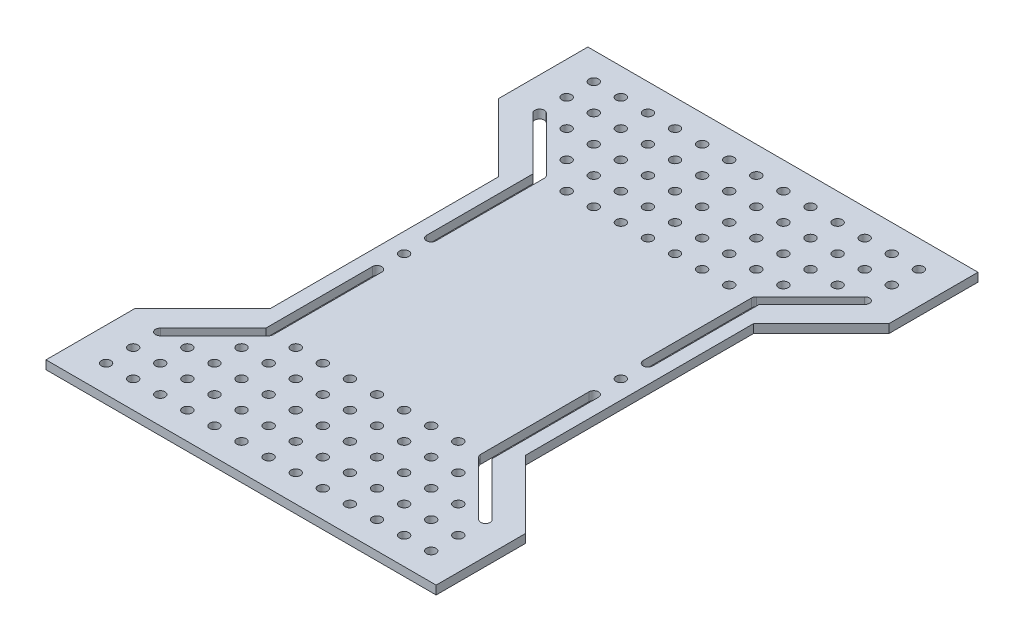
from build123d import *

# Parameters (mm, degrees)
CROQUIS1_R              = 1.75
SALIENTE_EXTRUIR1_DEPTH = 3.175
CORTAR_EXTRUIR1_DEPTH   = 247.467199897
CORTAR_EXTRUIR2_DEPTH   = 247.467199897


with BuildPart() as part:
    # Croquis1 → Saliente-Extruir1 (new body)
    with BuildSketch(Plane(origin=(0, 0, 0), x_dir=(1, 0, 0), z_dir=(0, 1, 0))):
        Polygon((25, 142.1), (25, 57.9), (0, 32.9), (0, 0), (144, 0), (144, 32.9), (119, 57.9), (119, 142.1), (144, 167.1), (144, 200), (0, 200), (0, 167.1), align=None)
        with Locations(Location((62.175, 20, 0), (0, 0, 270))):
            Circle(CROQUIS1_R, mode=Mode.SUBTRACT)
        with Locations(Location((92.175, 10, 0), (0, 0, 270))):
            Circle(CROQUIS1_R, mode=Mode.SUBTRACT)
        with Locations(Location((122.175, 10, 0), (0, 0, 270))):
            Circle(CROQUIS1_R, mode=Mode.SUBTRACT)
        with Locations(Location((132.175, 10, 0), (0, 0, 270))):
            Circle(CROQUIS1_R, mode=Mode.SUBTRACT)
        with Locations(Location((102.175, 10, 0), (0, 0, 270))):
            Circle(CROQUIS1_R, mode=Mode.SUBTRACT)
        with Locations(Location((112.175, 10, 0), (0, 0, 270))):
            Circle(CROQUIS1_R, mode=Mode.SUBTRACT)
        with Locations(Location((42.175, 20, 0), (0, 0, 270))):
            Circle(CROQUIS1_R, mode=Mode.SUBTRACT)
        with Locations(Location((52.175, 20, 0), (0, 0, 270))):
            Circle(CROQUIS1_R, mode=Mode.SUBTRACT)
        with Locations(Location((22.175, 20, 0), (0, 0, 270))):
            Circle(CROQUIS1_R, mode=Mode.SUBTRACT)
        with Locations(Location((32.175, 20, 0), (0, 0, 270))):
            Circle(CROQUIS1_R, mode=Mode.SUBTRACT)
        with Locations(Location((42.175, 10, 0), (0, 0, 270))):
            Circle(CROQUIS1_R, mode=Mode.SUBTRACT)
        with Locations(Location((52.175, 10, 0), (0, 0, 270))):
            Circle(CROQUIS1_R, mode=Mode.SUBTRACT)
        with Locations(Location((22.175, 10, 0), (0, 0, 270))):
            Circle(CROQUIS1_R, mode=Mode.SUBTRACT)
        with Locations(Location((32.175, 10, 0), (0, 0, 270))):
            Circle(CROQUIS1_R, mode=Mode.SUBTRACT)
        with Locations(Location((72.175, 10, 0), (0, 0, 270))):
            Circle(CROQUIS1_R, mode=Mode.SUBTRACT)
        with Locations(Location((122.175, 40, 0), (0, 0, 270))):
            Circle(CROQUIS1_R, mode=Mode.SUBTRACT)
        with Locations(Location((32.175, 50, 0), (0, 0, 270))):
            Circle(CROQUIS1_R, mode=Mode.SUBTRACT)
        with Locations(Location((102.175, 40, 0), (0, 0, 270))):
            Circle(CROQUIS1_R, mode=Mode.SUBTRACT)
        with Locations(Location((112.175, 40, 0), (0, 0, 270))):
            Circle(CROQUIS1_R, mode=Mode.SUBTRACT)
        with Locations(Location((72.175, 40, 0), (0, 0, 270))):
            Circle(CROQUIS1_R, mode=Mode.SUBTRACT)
        with Locations(Location((62.175, 40, 0), (0, 0, 270))):
            Circle(CROQUIS1_R, mode=Mode.SUBTRACT)
        with Locations(Location((92.175, 40, 0), (0, 0, 270))):
            Circle(CROQUIS1_R, mode=Mode.SUBTRACT)
        with Locations(Location((82.175, 40, 0), (0, 0, 270))):
            Circle(CROQUIS1_R, mode=Mode.SUBTRACT)
        with Locations(Location((122.175, 30, 0), (0, 0, 270))):
            Circle(CROQUIS1_R, mode=Mode.SUBTRACT)
        with Locations(Location((132.175, 30, 0), (0, 0, 270))):
            Circle(CROQUIS1_R, mode=Mode.SUBTRACT)
        with Locations(Location((102.175, 30, 0), (0, 0, 270))):
            Circle(CROQUIS1_R, mode=Mode.SUBTRACT)
        with Locations(Location((112.175, 30, 0), (0, 0, 270))):
            Circle(CROQUIS1_R, mode=Mode.SUBTRACT)
        with Locations(Location((42.175, 40, 0), (0, 0, 270))):
            Circle(CROQUIS1_R, mode=Mode.SUBTRACT)
        with Locations(Location((52.175, 40, 0), (0, 0, 270))):
            Circle(CROQUIS1_R, mode=Mode.SUBTRACT)
        with Locations(Location((22.175, 40, 0), (0, 0, 270))):
            Circle(CROQUIS1_R, mode=Mode.SUBTRACT)
        with Locations(Location((32.175, 40, 0), (0, 0, 270))):
            Circle(CROQUIS1_R, mode=Mode.SUBTRACT)
        with Locations(Location((132.175, 180, 0), (0, 0, 270))):
            Circle(CROQUIS1_R, mode=Mode.SUBTRACT)
        with Locations(Location((22.175, 190, 0), (0, 0, 270))):
            Circle(CROQUIS1_R, mode=Mode.SUBTRACT)
        with Locations(Location((12.175, 30, 0), (0, 0, 270))):
            Circle(CROQUIS1_R, mode=Mode.SUBTRACT)
        with Locations(Location((12.175, 170, 0), (0, 0, 270))):
            Circle(CROQUIS1_R, mode=Mode.SUBTRACT)
        with Locations(Location((12.175, 190, 0), (0, 0, 270))):
            Circle(CROQUIS1_R, mode=Mode.SUBTRACT)
        with Locations(Location((12.175, 180, 0), (0, 0, 270))):
            Circle(CROQUIS1_R, mode=Mode.SUBTRACT)
        with Locations(Location((12.175, 20, 0), (0, 0, 270))):
            Circle(CROQUIS1_R, mode=Mode.SUBTRACT)
        with Locations(Location((132.175, 190, 0), (0, 0, 270))):
            Circle(CROQUIS1_R, mode=Mode.SUBTRACT)
        with Locations(Location((92.175, 190, 0), (0, 0, 270))):
            Circle(CROQUIS1_R, mode=Mode.SUBTRACT)
        with Locations(Location((102.175, 190, 0), (0, 0, 270))):
            Circle(CROQUIS1_R, mode=Mode.SUBTRACT)
        with Locations(Location((112.175, 180, 0), (0, 0, 270))):
            Circle(CROQUIS1_R, mode=Mode.SUBTRACT)
        with Locations(Location((122.175, 180, 0), (0, 0, 270))):
            Circle(CROQUIS1_R, mode=Mode.SUBTRACT)
        with Locations(Location((92.175, 180, 0), (0, 0, 270))):
            Circle(CROQUIS1_R, mode=Mode.SUBTRACT)
        with Locations(Location((102.175, 180, 0), (0, 0, 270))):
            Circle(CROQUIS1_R, mode=Mode.SUBTRACT)
        with Locations(Location((32.175, 190, 0), (0, 0, 270))):
            Circle(CROQUIS1_R, mode=Mode.SUBTRACT)
        with Locations(Location((42.175, 190, 0), (0, 0, 270))):
            Circle(CROQUIS1_R, mode=Mode.SUBTRACT)
        with Locations(Location((42.175, 30, 0), (0, 0, 270))):
            Circle(CROQUIS1_R, mode=Mode.SUBTRACT)
        with Locations(Location((52.175, 30, 0), (0, 0, 270))):
            Circle(CROQUIS1_R, mode=Mode.SUBTRACT)
        with Locations(Location((22.175, 30, 0), (0, 0, 270))):
            Circle(CROQUIS1_R, mode=Mode.SUBTRACT)
        with Locations(Location((32.175, 30, 0), (0, 0, 270))):
            Circle(CROQUIS1_R, mode=Mode.SUBTRACT)
        with Locations(Location((82.175, 30, 0), (0, 0, 270))):
            Circle(CROQUIS1_R, mode=Mode.SUBTRACT)
        with Locations(Location((92.175, 30, 0), (0, 0, 270))):
            Circle(CROQUIS1_R, mode=Mode.SUBTRACT)
        with Locations(Location((62.175, 30, 0), (0, 0, 270))):
            Circle(CROQUIS1_R, mode=Mode.SUBTRACT)
        with Locations(Location((72.175, 30, 0), (0, 0, 270))):
            Circle(CROQUIS1_R, mode=Mode.SUBTRACT)
        with Locations(Location((92.175, 20, 0), (0, 0, 270))):
            Circle(CROQUIS1_R, mode=Mode.SUBTRACT)
        with Locations(Location((72.175, 20, 0), (0, 0, 270))):
            Circle(CROQUIS1_R, mode=Mode.SUBTRACT)
        with Locations(Location((122.175, 20, 0), (0, 0, 270))):
            Circle(CROQUIS1_R, mode=Mode.SUBTRACT)
        with Locations(Location((132.175, 20, 0), (0, 0, 270))):
            Circle(CROQUIS1_R, mode=Mode.SUBTRACT)
        with Locations(Location((102.175, 20, 0), (0, 0, 270))):
            Circle(CROQUIS1_R, mode=Mode.SUBTRACT)
        with Locations(Location((112.175, 20, 0), (0, 0, 270))):
            Circle(CROQUIS1_R, mode=Mode.SUBTRACT)
        with Locations(Location((32.175, 60, 0), (0, 0, 270))):
            Circle(CROQUIS1_R, mode=Mode.SUBTRACT)
        with Locations(Location((62.175, 50, 0), (0, 0, 270))):
            Circle(CROQUIS1_R, mode=Mode.SUBTRACT)
        with Locations(Location((72.175, 50, 0), (0, 0, 270))):
            Circle(CROQUIS1_R, mode=Mode.SUBTRACT)
        with Locations(Location((42.175, 50, 0), (0, 0, 270))):
            Circle(CROQUIS1_R, mode=Mode.SUBTRACT)
        with Locations(Location((52.175, 50, 0), (0, 0, 270))):
            Circle(CROQUIS1_R, mode=Mode.SUBTRACT)
        with Locations(Location((102.175, 50, 0), (0, 0, 270))):
            Circle(CROQUIS1_R, mode=Mode.SUBTRACT)
        with Locations(Location((112.175, 50, 0), (0, 0, 270))):
            Circle(CROQUIS1_R, mode=Mode.SUBTRACT)
        with Locations(Location((82.175, 50, 0), (0, 0, 270))):
            Circle(CROQUIS1_R, mode=Mode.SUBTRACT)
        with Locations(Location((92.175, 50, 0), (0, 0, 270))):
            Circle(CROQUIS1_R, mode=Mode.SUBTRACT)
        with Locations(Location((32.175, 70, 0), (0, 0, 270))):
            Circle(CROQUIS1_R, mode=Mode.SUBTRACT)
        with Locations(Location((112.175, 60, 0), (0, 0, 270))):
            Circle(CROQUIS1_R, mode=Mode.SUBTRACT)
        with Locations(Location((32.175, 80, 0), (0, 0, 270))):
            Circle(CROQUIS1_R, mode=Mode.SUBTRACT)
        with Locations(Location((112.175, 70, 0), (0, 0, 270))):
            Circle(CROQUIS1_R, mode=Mode.SUBTRACT)
        with Locations(Location((32.175, 90, 0), (0, 0, 270))):
            Circle(CROQUIS1_R, mode=Mode.SUBTRACT)
        with Locations(Location((112.175, 80, 0), (0, 0, 270))):
            Circle(CROQUIS1_R, mode=Mode.SUBTRACT)
        with Locations(Location((32.175, 100, 0), (0, 0, 270))):
            Circle(CROQUIS1_R, mode=Mode.SUBTRACT)
        with Locations(Location((112.175, 90, 0), (0, 0, 270))):
            Circle(CROQUIS1_R, mode=Mode.SUBTRACT)
        with Locations(Location((32.175, 110, 0), (0, 0, 270))):
            Circle(CROQUIS1_R, mode=Mode.SUBTRACT)
        with Locations(Location((112.175, 100, 0), (0, 0, 270))):
            Circle(CROQUIS1_R, mode=Mode.SUBTRACT)
        with Locations(Location((32.175, 120, 0), (0, 0, 270))):
            Circle(CROQUIS1_R, mode=Mode.SUBTRACT)
        with Locations(Location((112.175, 110, 0), (0, 0, 270))):
            Circle(CROQUIS1_R, mode=Mode.SUBTRACT)
        with Locations(Location((102.175, 160, 0), (0, 0, 270))):
            Circle(CROQUIS1_R, mode=Mode.SUBTRACT)
        with Locations(Location((112.175, 160, 0), (0, 0, 270))):
            Circle(CROQUIS1_R, mode=Mode.SUBTRACT)
        with Locations(Location((82.175, 160, 0), (0, 0, 270))):
            Circle(CROQUIS1_R, mode=Mode.SUBTRACT)
        with Locations(Location((92.175, 160, 0), (0, 0, 270))):
            Circle(CROQUIS1_R, mode=Mode.SUBTRACT)
        with Locations(Location((32.175, 170, 0), (0, 0, 270))):
            Circle(CROQUIS1_R, mode=Mode.SUBTRACT)
        with Locations(Location((42.175, 170, 0), (0, 0, 270))):
            Circle(CROQUIS1_R, mode=Mode.SUBTRACT)
        with Locations(Location((42.175, 150, 0), (0, 0, 270))):
            Circle(CROQUIS1_R, mode=Mode.SUBTRACT)
        with Locations(Location((52.175, 150, 0), (0, 0, 270))):
            Circle(CROQUIS1_R, mode=Mode.SUBTRACT)
        with Locations(Location((92.175, 150, 0), (0, 0, 270))):
            Circle(CROQUIS1_R, mode=Mode.SUBTRACT)
        with Locations(Location((82.175, 150, 0), (0, 0, 270))):
            Circle(CROQUIS1_R, mode=Mode.SUBTRACT)
        with Locations(Location((32.175, 150, 0), (0, 0, 270))):
            Circle(CROQUIS1_R, mode=Mode.SUBTRACT)
        with Locations(Location((112.175, 140, 0), (0, 0, 270))):
            Circle(CROQUIS1_R, mode=Mode.SUBTRACT)
        with Locations(Location((32.175, 130, 0), (0, 0, 270))):
            Circle(CROQUIS1_R, mode=Mode.SUBTRACT)
        with Locations(Location((112.175, 120, 0), (0, 0, 270))):
            Circle(CROQUIS1_R, mode=Mode.SUBTRACT)
        with Locations(Location((72.175, 190, 0), (0, 0, 270))):
            Circle(CROQUIS1_R, mode=Mode.SUBTRACT)
        with Locations(Location((82.175, 190, 0), (0, 0, 270))):
            Circle(CROQUIS1_R, mode=Mode.SUBTRACT)
        with Locations(Location((52.175, 190, 0), (0, 0, 270))):
            Circle(CROQUIS1_R, mode=Mode.SUBTRACT)
        with Locations(Location((62.175, 190, 0), (0, 0, 270))):
            Circle(CROQUIS1_R, mode=Mode.SUBTRACT)
        with Locations(Location((112.175, 190, 0), (0, 0, 270))):
            Circle(CROQUIS1_R, mode=Mode.SUBTRACT)
        with Locations(Location((122.175, 190, 0), (0, 0, 270))):
            Circle(CROQUIS1_R, mode=Mode.SUBTRACT)
        with Locations(Location((62.175, 150, 0), (0, 0, 270))):
            Circle(CROQUIS1_R, mode=Mode.SUBTRACT)
        with Locations(Location((72.175, 150, 0), (0, 0, 270))):
            Circle(CROQUIS1_R, mode=Mode.SUBTRACT)
        with Locations(Location((32.175, 140, 0), (0, 0, 270))):
            Circle(CROQUIS1_R, mode=Mode.SUBTRACT)
        with Locations(Location((42.175, 160, 0), (0, 0, 270))):
            Circle(CROQUIS1_R, mode=Mode.SUBTRACT)
        with Locations(Location((52.175, 160, 0), (0, 0, 270))):
            Circle(CROQUIS1_R, mode=Mode.SUBTRACT)
        with Locations(Location((32.175, 180, 0), (0, 0, 270))):
            Circle(CROQUIS1_R, mode=Mode.SUBTRACT)
        with Locations(Location((42.175, 180, 0), (0, 0, 270))):
            Circle(CROQUIS1_R, mode=Mode.SUBTRACT)
        with Locations(Location((82.175, 180, 0), (0, 0, 270))):
            Circle(CROQUIS1_R, mode=Mode.SUBTRACT)
        with Locations(Location((72.175, 180, 0), (0, 0, 270))):
            Circle(CROQUIS1_R, mode=Mode.SUBTRACT)
        with Locations(Location((22.175, 180, 0), (0, 0, 270))):
            Circle(CROQUIS1_R, mode=Mode.SUBTRACT)
        with Locations(Location((132.175, 170, 0), (0, 0, 270))):
            Circle(CROQUIS1_R, mode=Mode.SUBTRACT)
        with Locations(Location((32.175, 160, 0), (0, 0, 270))):
            Circle(CROQUIS1_R, mode=Mode.SUBTRACT)
        with Locations(Location((22.175, 160, 0), (0, 0, 270))):
            Circle(CROQUIS1_R, mode=Mode.SUBTRACT)
        with Locations(Location((22.175, 170, 0), (0, 0, 270))):
            Circle(CROQUIS1_R, mode=Mode.SUBTRACT)
        with Locations(Location((122.175, 160, 0), (0, 0, 270))):
            Circle(CROQUIS1_R, mode=Mode.SUBTRACT)
        with Locations(Location((102.175, 150, 0), (0, 0, 270))):
            Circle(CROQUIS1_R, mode=Mode.SUBTRACT)
        with Locations(Location((112.175, 150, 0), (0, 0, 270))):
            Circle(CROQUIS1_R, mode=Mode.SUBTRACT)
        with Locations(Location((62.175, 160, 0), (0, 0, 270))):
            Circle(CROQUIS1_R, mode=Mode.SUBTRACT)
        with Locations(Location((72.175, 160, 0), (0, 0, 270))):
            Circle(CROQUIS1_R, mode=Mode.SUBTRACT)
        with Locations(Location((92.175, 170, 0), (0, 0, 270))):
            Circle(CROQUIS1_R, mode=Mode.SUBTRACT)
        with Locations(Location((102.175, 170, 0), (0, 0, 270))):
            Circle(CROQUIS1_R, mode=Mode.SUBTRACT)
        with Locations(Location((112.175, 130, 0), (0, 0, 270))):
            Circle(CROQUIS1_R, mode=Mode.SUBTRACT)
        with Locations(Location((52.175, 180, 0), (0, 0, 270))):
            Circle(CROQUIS1_R, mode=Mode.SUBTRACT)
        with Locations(Location((62.175, 180, 0), (0, 0, 270))):
            Circle(CROQUIS1_R, mode=Mode.SUBTRACT)
        with Locations(Location((72.175, 170, 0), (0, 0, 270))):
            Circle(CROQUIS1_R, mode=Mode.SUBTRACT)
        with Locations(Location((82.175, 170, 0), (0, 0, 270))):
            Circle(CROQUIS1_R, mode=Mode.SUBTRACT)
        with Locations(Location((52.175, 170, 0), (0, 0, 270))):
            Circle(CROQUIS1_R, mode=Mode.SUBTRACT)
        with Locations(Location((62.175, 170, 0), (0, 0, 270))):
            Circle(CROQUIS1_R, mode=Mode.SUBTRACT)
        with Locations(Location((112.175, 170, 0), (0, 0, 270))):
            Circle(CROQUIS1_R, mode=Mode.SUBTRACT)
        with Locations(Location((122.175, 170, 0), (0, 0, 270))):
            Circle(CROQUIS1_R, mode=Mode.SUBTRACT)
        with Locations(Location((12.175, 10, 0), (0, 0, 270))):
            Circle(CROQUIS1_R, mode=Mode.SUBTRACT)
        with Locations(Location((62.175, 10, 0), (0, 0, 270))):
            Circle(CROQUIS1_R, mode=Mode.SUBTRACT)
        with Locations(Location((82.175, 20, 0), (0, 0, 270))):
            Circle(CROQUIS1_R, mode=Mode.SUBTRACT)
        with Locations(Location((82.175, 10, 0), (0, 0, 270))):
            Circle(CROQUIS1_R, mode=Mode.SUBTRACT)
    extrude(amount=SALIENTE_EXTRUIR1_DEPTH)

    # Croquis2 → Cortar-Extruir1 (cut, through all)
    with BuildSketch(Plane(origin=(0, 3.175, 0), x_dir=(1, 0, 0), z_dir=(0, 1, 0))):
        with BuildLine():
            Line((33.925, 150), (33.925, 110))
            ThreePointArc((33.925, 110), (32.175, 108.25), (30.425, 110))
            Line((30.425, 110), (30.425, 150))
            ThreePointArc((30.425, 150), (32.175, 151.75), (33.925, 150))
        make_face()
        with BuildLine():
            Line((33.925, 50), (33.925, 90))
            ThreePointArc((33.925, 90), (32.175, 91.75), (30.425, 90))
            Line((30.425, 90), (30.425, 50))
            ThreePointArc((30.425, 50), (32.175, 48.25), (33.925, 50))
        make_face()
        with BuildLine():
            Line((110.425, 50), (110.425, 90))
            ThreePointArc((110.425, 90), (112.175, 91.75), (113.925, 90))
            Line((113.925, 90), (113.925, 50))
            ThreePointArc((113.925, 50), (112.175, 48.25), (110.425, 50))
        make_face()
        with BuildLine():
            Line((110.425, 150), (110.425, 110))
            ThreePointArc((110.425, 110), (112.175, 108.25), (113.925, 110))
            Line((113.925, 110), (113.925, 150))
            ThreePointArc((113.925, 150), (112.175, 151.75), (110.425, 150))
        make_face()
    extrude(amount=-CORTAR_EXTRUIR1_DEPTH, mode=Mode.SUBTRACT)

    # Croquis3 → Cortar-Extruir2 (cut, through all)
    with BuildSketch(Plane(origin=(0, 3.175, 0), x_dir=(1, 0, 0), z_dir=(0, 1, 0))):
        with BuildLine():
            Line((30.937563133, 148.762563133), (10.937563133, 168.762563133))
            ThreePointArc((10.937563133, 168.762563133), (10.937563133, 171.237436867), (13.412436867, 171.237436867))
            Line((13.412436867, 171.237436867), (33.412436867, 151.237436867))
            ThreePointArc((33.412436867, 151.237436867), (33.412436867, 148.762563133), (30.937563133, 148.762563133))
        make_face()
        with BuildLine():
            Line((113.412436867, 148.762563133), (133.412436867, 168.762563133))
            ThreePointArc((133.412436867, 168.762563133), (133.412436867, 171.237436867), (130.937563133, 171.237436867))
            Line((130.937563133, 171.237436867), (110.937563133, 151.237436867))
            ThreePointArc((110.937563133, 151.237436867), (110.937563133, 148.762563133), (113.412436867, 148.762563133))
        make_face()
        with BuildLine():
            Line((30.937563133, 51.237436867), (10.937563133, 31.237436867))
            ThreePointArc((10.937563133, 31.237436867), (10.937563133, 28.762563133), (13.412436867, 28.762563133))
            Line((13.412436867, 28.762563133), (33.412436867, 48.762563133))
            ThreePointArc((33.412436867, 48.762563133), (33.412436867, 51.237436867), (30.937563133, 51.237436867))
        make_face()
        with BuildLine():
            Line((113.412436867, 51.237436867), (133.412436867, 31.237436867))
            ThreePointArc((133.412436867, 31.237436867), (133.412436867, 28.762563133), (130.937563133, 28.762563133))
            Line((130.937563133, 28.762563133), (110.937563133, 48.762563133))
            ThreePointArc((110.937563133, 48.762563133), (110.937563133, 51.237436867), (113.412436867, 51.237436867))
        make_face()
    extrude(amount=-CORTAR_EXTRUIR2_DEPTH, mode=Mode.SUBTRACT)


solid = part.part
